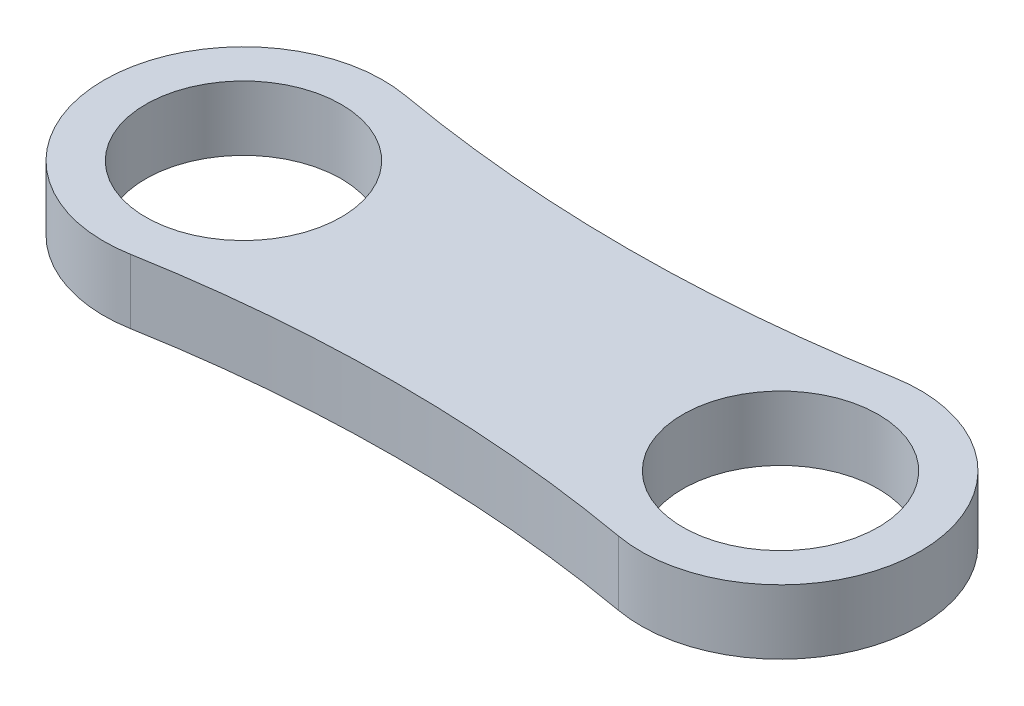
from build123d import *

# Parameters (mm, degrees)
SKETCH3_R           = 1.1557
BOSS_EXTRUDE1_DEPTH = 0.762


with BuildPart() as part:
    # Sketch3 → Boss-Extrude1 (new body)
    with BuildSketch(Plane(origin=(0, 0, 0), x_dir=(1, 0, 0), z_dir=(0, 1, 0))):
        with BuildLine():
            ThreePointArc((-2.886363636, 1.62557376), (-4.826, 0), (-2.886363636, -1.62557376))
            ThreePointArc((-2.886363636, -1.62557376), (0, -1.371311361), (2.886363636, -1.62557376))
            ThreePointArc((2.886363636, -1.62557376), (4.826, 0), (2.886363636, 1.62557376))
            ThreePointArc((2.886363636, 1.62557376), (0, 1.371311361), (-2.886363636, 1.62557376))
        make_face()
        with Locations(Location((-3.175, 0, 0), (0, 0, 90))):
            Circle(SKETCH3_R, mode=Mode.SUBTRACT)
        with Locations(Location((3.175, 0, 0), (0, 0, 90))):
            Circle(SKETCH3_R, mode=Mode.SUBTRACT)
    extrude(amount=BOSS_EXTRUDE1_DEPTH)


solid = part.part
